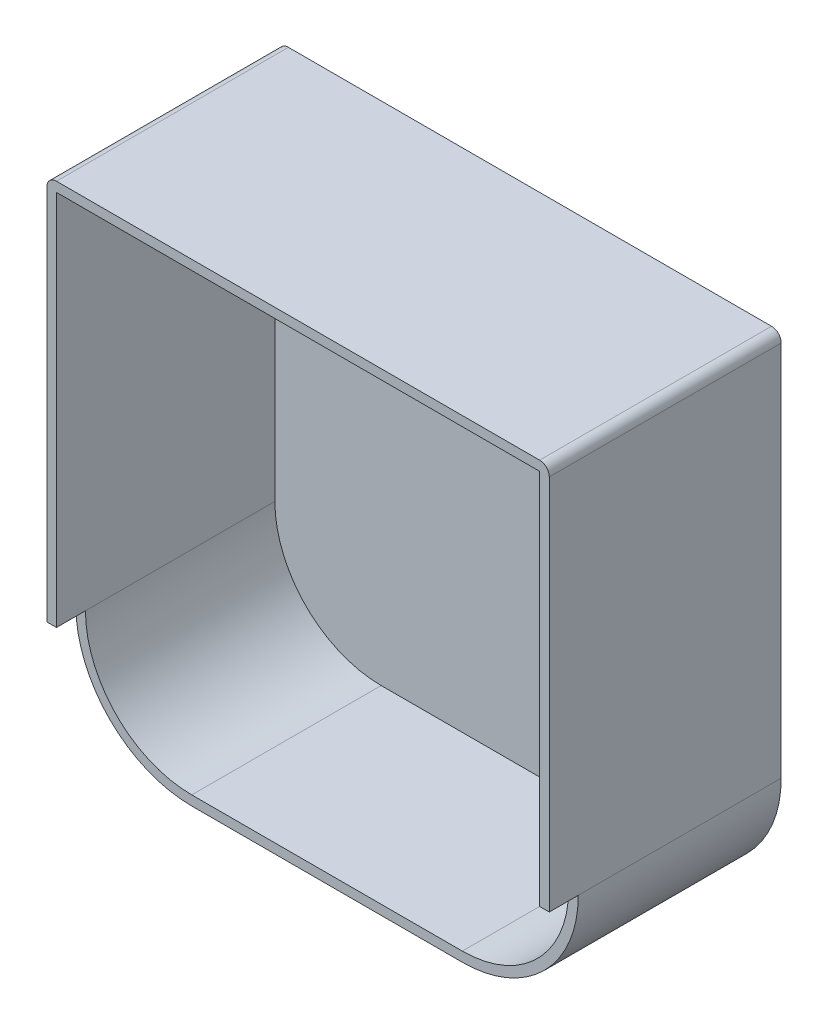
from build123d import *

# Parameters (mm, degrees)
ESQUISSE2_W             = 260
ESQUISSE2_H             = 260
BOSS_EXTRU_1_DEPTH      = 120
CONG_1_R                = 60
CONG_2_R                = 5
ENL_V_MAT_EXTRU_1_DEPTH = 113
ESQUISSE4_W             = 260
ESQUISSE4_H             = 60
ENL_V_MAT_EXTRU_2_DEPTH = 15
ENL_V_MAT_EXTRU_3_DEPTH = 4
ENL_V_MAT_EXTRU_4_DEPTH = 10


with BuildPart() as part:
    # Esquisse2 → Boss.-Extru.1 (new body)
    with BuildSketch(Plane.XY):
        with Locations((130, 130)):
            Rectangle(ESQUISSE2_W, ESQUISSE2_H)
    extrude(amount=BOSS_EXTRU_1_DEPTH)

    # Congé1
    cong_1_edges = [part.edges().sort_by_distance(p)[0] for p in [
        (260, 0, 60),
        (0, 0, 60),
    ]]
    fillet(cong_1_edges, radius=CONG_1_R)

    # Congé2
    cong_2_edges = [part.edges().sort_by_distance(p)[0] for p in [
        (0, 260, 60),
        (260, 260, 60),
    ]]
    fillet(cong_2_edges, radius=CONG_2_R)

    # Esquisse3 → Enlèv. mat.-Extru.1 (cut)
    with BuildSketch(Plane.XY.offset(120)):
        with BuildLine():
            Line((5, 255), (255, 255))
            Line((255, 255), (255, 60))
            ThreePointArc((255, 60), (238.890872965, 21.109127035), (200, 5))
            Line((200, 5), (60, 5))
            ThreePointArc((60, 5), (21.109127035, 21.109127035), (5, 60))
            Line((5, 60), (5, 255))
        make_face()
    extrude(amount=-ENL_V_MAT_EXTRU_1_DEPTH, mode=Mode.SUBTRACT)

    # Esquisse4 → Enlèv. mat.-Extru.2 (cut)
    with BuildSketch(Plane.XY.offset(120)):
        with Locations((130, 30)):
            Rectangle(ESQUISSE4_W, ESQUISSE4_H)
    extrude(amount=-ENL_V_MAT_EXTRU_2_DEPTH, mode=Mode.SUBTRACT)

    # Esquisse5 → Enlèv. mat.-Extru.3 (cut)
    with BuildSketch(Plane(origin=(0, 0, 0), x_dir=(-1, 0, 0), z_dir=(0, 0, -1))):
        with BuildLine():
            Line((-240, 120), (-240, 230))
            ThreePointArc((-240, 230), (-237.071067812, 237.071067812), (-230, 240))
            Line((-230, 240), (-30, 240))
            ThreePointArc((-30, 240), (-22.928932188, 237.071067812), (-20, 230))
            Line((-20, 230), (-20, 120))
            Line((-20, 120), (-45, 120))
            Line((-45, 120), (-45, 205))
            ThreePointArc((-45, 205), (-47.928932188, 212.071067812), (-55, 215))
            Line((-55, 215), (-205, 215))
            ThreePointArc((-205, 215), (-212.071067812, 212.071067812), (-215, 205))
            Line((-215, 205), (-215, 120))
            Line((-215, 120), (-240, 120))
        make_face()
    extrude(amount=-ENL_V_MAT_EXTRU_3_DEPTH, mode=Mode.SUBTRACT)

    # Esquisse6 → Enlèv. mat.-Extru.4 (cut)
    with BuildSketch(Plane(origin=(0, 0, 4), x_dir=(-1, 0, 0), z_dir=(0, 0, -1))):
        with BuildLine():
            Line((-39.5, 238.5), (-59.5, 238.5))
            ThreePointArc((-59.5, 238.5), (-70.5, 227.5), (-59.5, 216.5))
            Line((-59.5, 216.5), (-39.5, 216.5))
            ThreePointArc((-39.5, 216.5), (-28.5, 227.5), (-39.5, 238.5))
        make_face()
    extrude(amount=-ENL_V_MAT_EXTRU_4_DEPTH, mode=Mode.SUBTRACT)


solid = part.part
